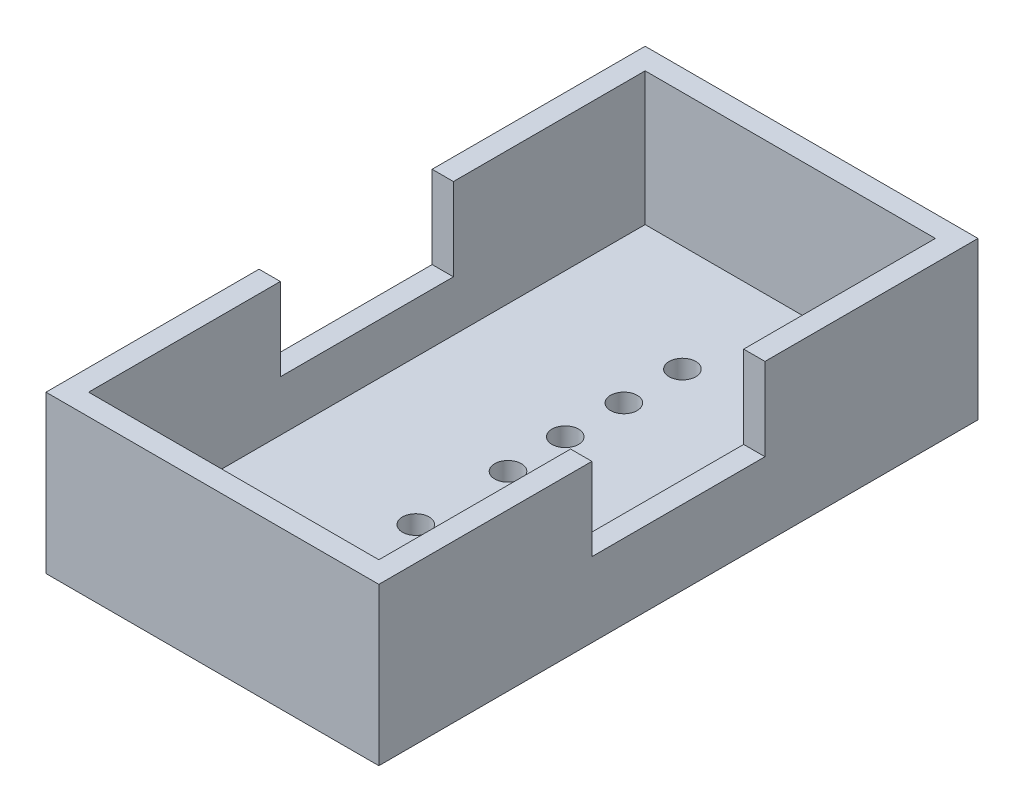
from build123d import *

# Parameters (mm, degrees)
SKETCH1_W           = 31.75
SKETCH1_H           = 57.15
BOSS_EXTRUDE1_DEPTH = 2.286
SKETCH2_W           = 31.75
SKETCH2_H           = 57.15
SKETCH2_W_2         = 27.686
SKETCH2_H_2         = 53.086
BOSS_EXTRUDE2_DEPTH = 12.7
SKETCH3_R           = 1.27
CUT_EXTRUDE1_DEPTH  = 36.06902123
SKETCH4_W           = 16.51
SKETCH4_H           = 7.874
CUT_EXTRUDE2_DEPTH  = 46.267795628


with BuildPart() as part:
    # Sketch1 → Boss-Extrude1 (new body)
    with BuildSketch(Plane(origin=(0, 0, 0), x_dir=(1, 0, 0), z_dir=(0, 1, 0))):
        Rectangle(SKETCH1_W, SKETCH1_H)
    extrude(amount=BOSS_EXTRUDE1_DEPTH)

    # Sketch2 → Boss-Extrude2 (add)
    with BuildSketch(Plane(origin=(0, 2.286, 0), x_dir=(1, 0, 0), z_dir=(0, 1, 0))):
        Rectangle(SKETCH2_W, SKETCH2_H)
        Rectangle(SKETCH2_W_2, SKETCH2_H_2, mode=Mode.SUBTRACT)
    extrude(amount=BOSS_EXTRUDE2_DEPTH)

    # Sketch3 → Cut-Extrude1 (cut, through all)
    with BuildSketch(Plane(origin=(0, 2.286, 0), x_dir=(1, 0, 0), z_dir=(0, 1, 0))):
        with Locations(Location((-0.127, 16.383, 0), (0, 0, 270))):
            Circle(SKETCH3_R)
        with Locations(Location((-0.127, 10.795, 0), (0, 0, 270))):
            Circle(SKETCH3_R)
        with Locations(Location((-0.127, 5.207, 0), (0, 0, 270))):
            Circle(SKETCH3_R)
        with Locations(Location((0, -0.381, 0), (0, 0, 270))):
            Circle(SKETCH3_R)
        with Locations(Location((0, -9.176980695, 0), (0, 0, 270))):
            Circle(SKETCH3_R)
    extrude(amount=-CUT_EXTRUDE1_DEPTH, mode=Mode.SUBTRACT)

    # Sketch4 → Cut-Extrude2 (cut, through all)
    with BuildSketch(Plane.ZY.offset(15.875)):
        with Locations((0, 11.049)):
            Rectangle(SKETCH4_W, SKETCH4_H)
    extrude(amount=-CUT_EXTRUDE2_DEPTH, mode=Mode.SUBTRACT)


solid = part.part
